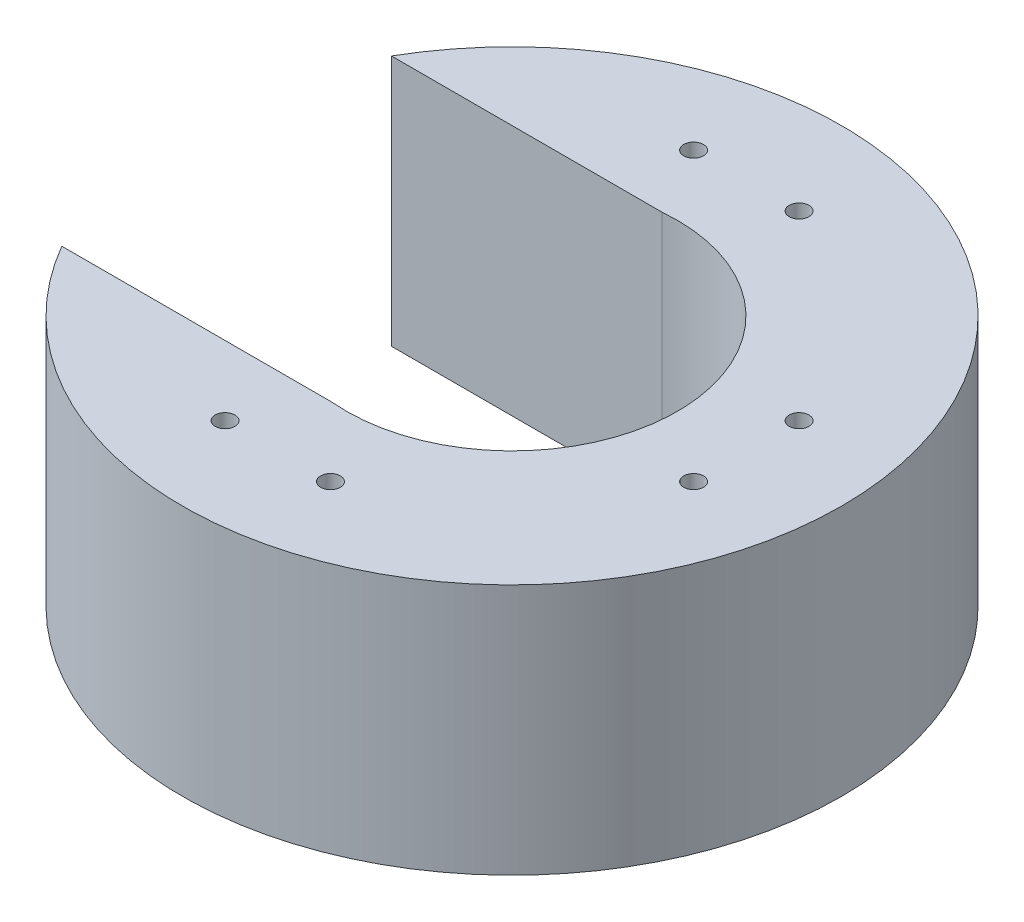
from build123d import *

# Parameters (mm, degrees)
SKETCH1_R           = 1.5
BOSS_EXTRUDE1_DEPTH = 38.15
SKETCH4_W           = 9.31
SKETCH4_H           = 38.15
CUT_EXTRUDE2_DEPTH  = 45


with BuildPart() as part:
    # Sketch1 → Boss-Extrude1 (new body)
    with BuildSketch(Plane(origin=(0, 0, 0), x_dir=(1, 0, 0), z_dir=(0, 1, 0))):
        with BuildLine():
            Line((-43.3, 25.002199903), (-19.589917361, 15.692199903))
            ThreePointArc((-19.589917361, 15.692199903), (25.1, 0), (-19.589917361, -15.692199903))
            Line((-19.589917361, -15.692199903), (-43.3, -25.002199903))
            ThreePointArc((-43.3, -25.002199903), (50, 0), (-43.3, 25.002199903))
        make_face()
        with Locations(Location((8, -35.55, 0), (0, 0, 270))):
            Circle(SKETCH1_R, mode=Mode.SUBTRACT)
        with Locations(Location((-8, -35.55, 0), (0, 0, 90))):
            Circle(SKETCH1_R, mode=Mode.SUBTRACT)
        with Locations(Location((8, 35.55, 0), (0, 0, 90))):
            Circle(SKETCH1_R, mode=Mode.SUBTRACT)
        with Locations(Location((-8, 35.55, 0), (0, 0, 270))):
            Circle(SKETCH1_R, mode=Mode.SUBTRACT)
        with Locations(Location((35.55, 8, 0), (0, 0, 270))):
            Circle(SKETCH1_R, mode=Mode.SUBTRACT)
        with Locations(Location((35.55, -8, 0), (0, 0, 90))):
            Circle(SKETCH1_R, mode=Mode.SUBTRACT)
    extrude(amount=BOSS_EXTRUDE1_DEPTH)

    # Sketch4 → Cut-Extrude2 (cut)
    with BuildSketch(Plane.ZY.offset(43.3)):
        with Locations((-20.347199903, 19.075)):
            Rectangle(SKETCH4_W, SKETCH4_H)
        with Locations((20.347199903, 19.075)):
            Rectangle(SKETCH4_W, SKETCH4_H)
    extrude(amount=-CUT_EXTRUDE2_DEPTH, mode=Mode.SUBTRACT)


solid = part.part
